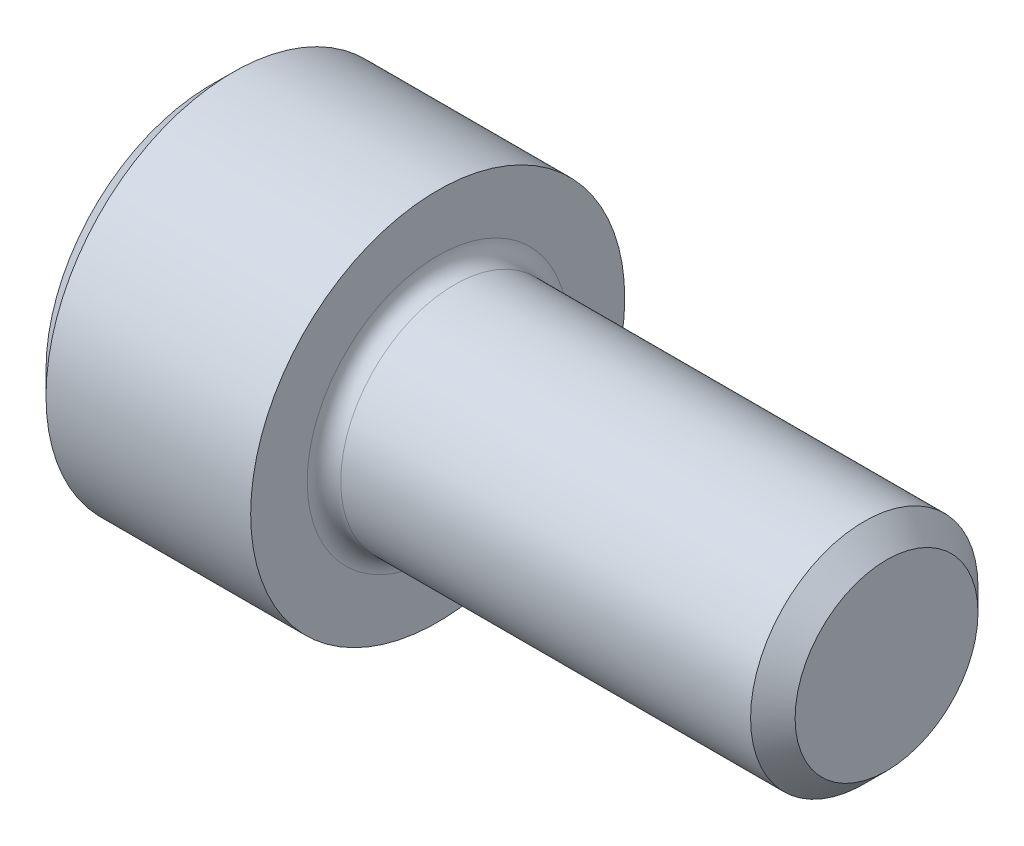
from build123d import *

# Parameters (mm, degrees)
FILLET1_R   = 0.3556
HEX_2_DEPTH = 2.286


with BuildPart() as part:
    # BodySke → Base-Revolve (revolve)
    with BuildSketch(Plane.XY, mode=Mode.PRIVATE) as base_revolve_sk:
        Polygon((0, 0), (0, 3.48615), (0.4826, 3.96875), (4.826, 3.96875), (4.826, 2.413), (13.87856, 2.413), (14.351, 1.94056), (14.351, 0), align=None)
    revolve(base_revolve_sk.sketch.rotate(Axis((-31.75, 0, 0), (1, 0, 0)), 90), axis=Axis((-31.75, 0, 0), (1, 0, 0)))

    # Fillet1
    fillet1_edges = [part.edges().sort_by_distance(p)[0] for p in [
        (4.826, 0, -2.413),
    ]]
    fillet(fillet1_edges, radius=FILLET1_R)

    # Sketch2 → Hex-PreBroach (revolve, cut)
    with BuildSketch(Plane.XY, mode=Mode.PRIVATE) as hex_prebroach_sk:
        Polygon((0, 1.98501), (2.286, 1.98501), (3.432046058, 0), (0, 0), align=None)
    revolve(hex_prebroach_sk.sketch.rotate(Axis((0, 0, 0), (1, 0, 0)), 90), axis=Axis((0, 0, 0), (1, 0, 0)), mode=Mode.SUBTRACT)

    # Sketch3 → Hex 2 (cut)
    with BuildSketch(Plane(origin=(0, 0, 0), x_dir=(0, 0.500000000000001, 0.866025403784438), z_dir=(-1, 0, 0))):
        Polygon((1.146046058, 1.98501), (-1.146046058, 1.98501), (-2.292092116, 0), (-1.146046058, -1.98501), (1.146046058, -1.98501), (2.292092116, 0), align=None)
    extrude(amount=-HEX_2_DEPTH, mode=Mode.SUBTRACT)


solid = part.part
